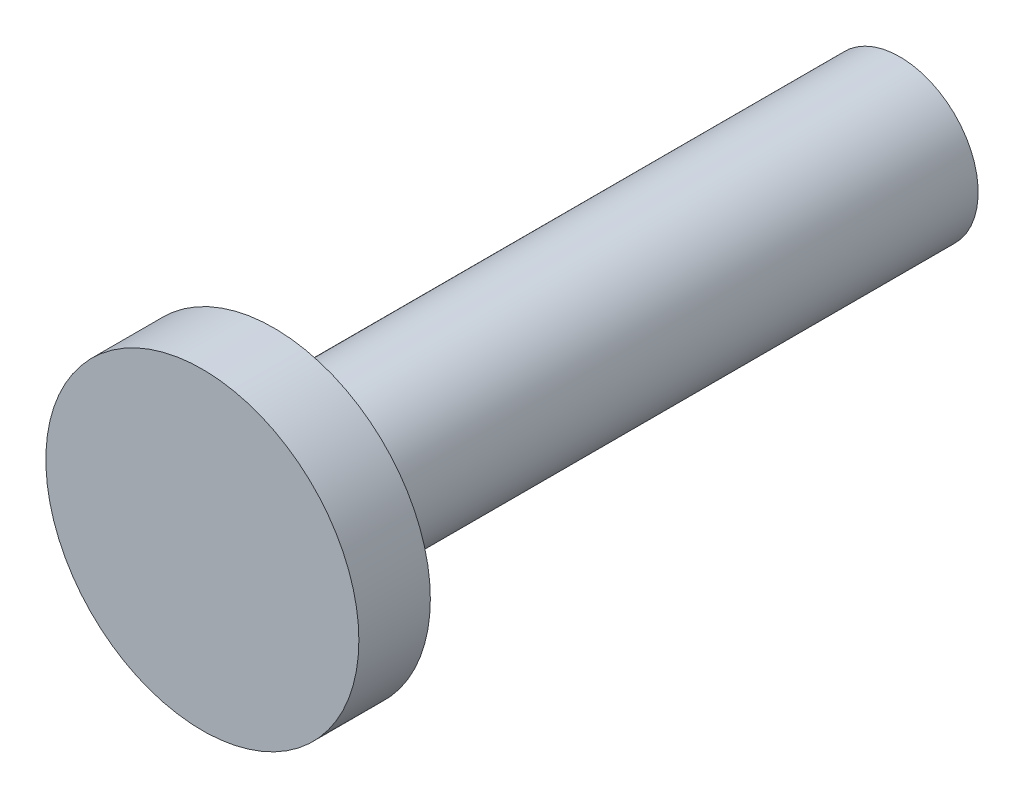
from build123d import *

# Parameters (mm, degrees)
ESQUISSE1_R        = 3
BOSS_EXTRU_1_DEPTH = 1.37
ESQUISSE2_R        = 1.5
BOSS_EXTRU_2_DEPTH = 12


with BuildPart() as part:
    # Esquisse1 → Boss.-Extru.1 (new body)
    with BuildSketch(Plane.XY):
        Circle(ESQUISSE1_R)
    extrude(amount=BOSS_EXTRU_1_DEPTH)

    # Esquisse2 → Boss.-Extru.2 (add)
    with BuildSketch(Plane(origin=(0, 0, 0), x_dir=(-1, 0, 0), z_dir=(0, 0, -1))):
        Circle(ESQUISSE2_R)
    extrude(amount=BOSS_EXTRU_2_DEPTH)


solid = part.part
